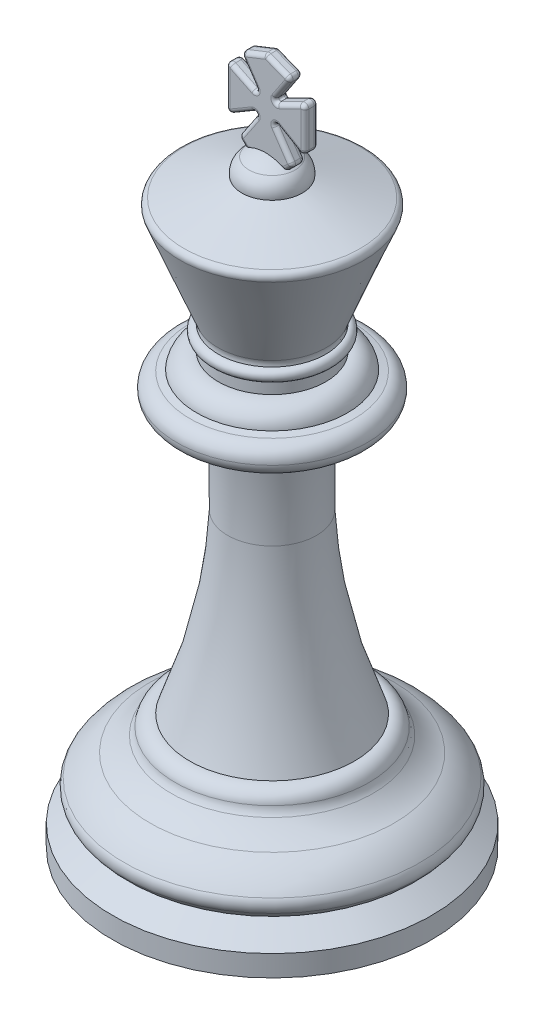
from build123d import *

# Parameters (mm, degrees)
BOSS_EXTRUDE1_DEPTH = 0.508
FILLET1_R           = 0.3048


with BuildPart() as part:
    # Sketch1 → Revolve1 (revolve)
    with BuildSketch(Plane.XY, mode=Mode.PRIVATE) as revolve1_sk:
        with BuildLine():
            Line((0, 0), (0, 46.398368268))
            ThreePointArc((0, 46.398368268), (-0.926441867, 46.251857659), (-1.762466306, 45.826624745))
            ThreePointArc((-1.762466306, 45.826624745), (-2.208377292, 45.273181891), (-2.313034142, 44.570200708))
            Line((-2.313034142, 44.570200708), (-6.75154614, 43.11078776))
            ThreePointArc((-6.75154614, 43.11078776), (-7.035654024, 42.85860525), (-7.046412356, 42.478871704))
            Line((-7.046412356, 42.478871704), (-4.156958095, 35.243427373))
            ThreePointArc((-4.156958095, 35.243427373), (-4.103369607, 35.017466312), (-4.117600631, 34.785674152))
            ThreePointArc((-4.117600631, 34.785674152), (-4.597032328, 34.347363393), (-4.117600631, 33.909052635))
            Line((-4.117600631, 33.909052635), (-4.117600631, 32.956925531))
            ThreePointArc((-4.117600631, 32.956925531), (-5.202780195, 32.681899303), (-5.775645112, 31.720088564))
            Line((-5.775645112, 31.720088564), (-6.306129065, 31.607474439))
            ThreePointArc((-6.306129065, 31.607474439), (-7.010584614, 31.246057823), (-7.293637672, 30.506625233))
            ThreePointArc((-7.293637672, 30.506625233), (-7.004403098, 29.8083512), (-6.306129065, 29.519116625))
            Line((-6.306129065, 29.519116625), (-3.802418707, 29.519116625))
            ThreePointArc((-3.802418707, 29.519116625), (-3.442665268, 25.969805948), (-3.398958786, 22.402577533))
            ThreePointArc((-3.398958786, 22.402577533), (-4.29332645, 15.523187233), (-6.306129065, 8.884322116))
            ThreePointArc((-6.306129065, 8.884322116), (-7.036226401, 8.680304305), (-7.436510754, 8.03653585))
            ThreePointArc((-7.436510754, 8.03653585), (-7.542598649, 7.725504097), (-7.732360503, 7.457202344))
            ThreePointArc((-7.732360503, 7.457202344), (-8.487308944, 6.799599472), (-9.353042621, 6.296713914))
            ThreePointArc((-9.353042621, 6.296713914), (-10.44703161, 5.606790145), (-11.32387211, 4.656023375))
            ThreePointArc((-11.32387211, 4.656023375), (-11.485448729, 4.145808634), (-11.32387211, 3.635593893))
            ThreePointArc((-11.32387211, 3.635593893), (-10.914811069, 3.174227609), (-10.413488945, 2.815248623))
            Line((-10.413488945, 2.815248623), (-12.234255275, 1.614743351))
            Line((-12.234255275, 1.614743351), (-12.234255275, 0))
            Line((-12.234255275, 0), (0, 0))
        make_face()
    revolve(revolve1_sk.sketch.rotate(Axis((0, 0, 0), (0, 1, 0)), 270), axis=Axis((0, 0, 0), (0, 1, 0)))


with BuildPart() as body_2:
    # Sketch2 → Boss-Extrude1 (new, symmetric)
    with BuildSketch(Plane.XY):
        with BuildLine():
            Line((-1.512569757, 45.826624745), (-2.08413173, 46.398186719))
            Line((-2.08413173, 46.398186719), (-0.737873309, 48.39135638))
            ThreePointArc((-0.737873309, 48.39135638), (-0.751595635, 48.563100842), (-0.922116355, 48.587741188))
            Line((-0.922116355, 48.587741188), (-3.01901751, 47.358364516))
            Line((-3.01901751, 47.358364516), (-3.01901751, 51.08554872))
            Line((-3.01901751, 51.08554872), (-0.912751127, 50.059513125))
            ThreePointArc((-0.912751127, 50.059513125), (-0.748273043, 50.092841621), (-0.737470079, 50.260314379))
            Line((-0.737470079, 50.260314379), (-1.961882886, 52.093721043))
            Line((-1.961882886, 52.093721043), (0, 52.870883986))
            Line((0, 52.870883986), (1.961882886, 52.093721043))
            Line((1.961882886, 52.093721043), (0.737470079, 50.260314379))
            ThreePointArc((0.737470079, 50.260314379), (0.748273043, 50.092841621), (0.912751127, 50.059513125))
            Line((0.912751127, 50.059513125), (3.01901751, 51.08554872))
            Line((3.01901751, 51.08554872), (3.01901751, 47.358364516))
            Line((3.01901751, 47.358364516), (0.922116355, 48.587741188))
            ThreePointArc((0.922116355, 48.587741188), (0.751595635, 48.563100842), (0.737873309, 48.39135638))
            Line((0.737873309, 48.39135638), (2.08413173, 46.398186719))
            Line((2.08413173, 46.398186719), (1.512569757, 45.826624745))
            Line((1.512569757, 45.826624745), (-1.512569757, 45.826624745))
        make_face()
    extrude(amount=BOSS_EXTRUDE1_DEPTH, both=True)

    # Fillet1
    fillet1_edges = [body_2.edges().sort_by_distance(p)[0] for p in [
        (1.41100252, 47.394771549, -0.508),
        (2.08413173, 46.398186719, 0),
        (1.41100252, 47.394771549, 0.508),
        (1.798350743, 46.112405732, 0.508),
        (0, 45.826624745, 0.508),
        (-1.798350743, 46.112405732, 0.508),
        (-1.41100252, 47.394771549, 0.508),
        (-0.751595635, 48.563100842, 0.508),
        (-1.970566932, 47.973052852, 0.508),
        (-3.01901751, 49.221956618, 0.508),
        (-1.965884318, 50.572530922, 0.508),
        (-0.748273043, 50.092841621, 0.508),
        (-1.349676482, 51.177017711, 0.508),
        (-0.980941443, 52.482302514, 0.508),
        (0.980941443, 52.482302514, 0.508),
        (1.349676482, 51.177017711, 0.508),
        (0.748273043, 50.092841621, 0.508),
        (1.965884318, 50.572530922, 0.508),
        (3.01901751, 49.221956618, 0.508),
        (1.970566932, 47.973052852, 0.508),
        (0.751595635, 48.563100842, 0.508),
        (3.01901751, 47.358364516, 0),
        (1.970566932, 47.973052852, -0.508),
        (3.01901751, 49.221956618, -0.508),
        (3.01901751, 51.08554872, 0),
        (1.965884318, 50.572530922, -0.508),
        (0.748273043, 50.092841621, -0.508),
        (1.349676482, 51.177017711, -0.508),
        (1.961882886, 52.093721043, 0),
        (0.980941443, 52.482302514, -0.508),
        (0, 52.870883986, 0),
        (-0.980941443, 52.482302514, -0.508),
        (-1.961882886, 52.093721043, 0),
        (-1.349676482, 51.177017711, -0.508),
        (-0.748273043, 50.092841621, -0.508),
        (-1.965884318, 50.572530922, -0.508),
        (-3.01901751, 51.08554872, 0),
        (-3.01901751, 49.221956618, -0.508),
        (-3.01901751, 47.358364516, 0),
        (-1.970566932, 47.973052852, -0.508),
        (-0.751595635, 48.563100842, -0.508),
        (-1.41100252, 47.394771549, -0.508),
        (-2.08413173, 46.398186719, 0),
        (-1.798350743, 46.112405732, -0.508),
        (0, 45.826624745, -0.508),
        (1.798350743, 46.112405732, -0.508),
        (0.751595635, 48.563100842, -0.508),
    ]]
    fillet(fillet1_edges, radius=FILLET1_R)


solid = Compound([part.part, body_2.part])
